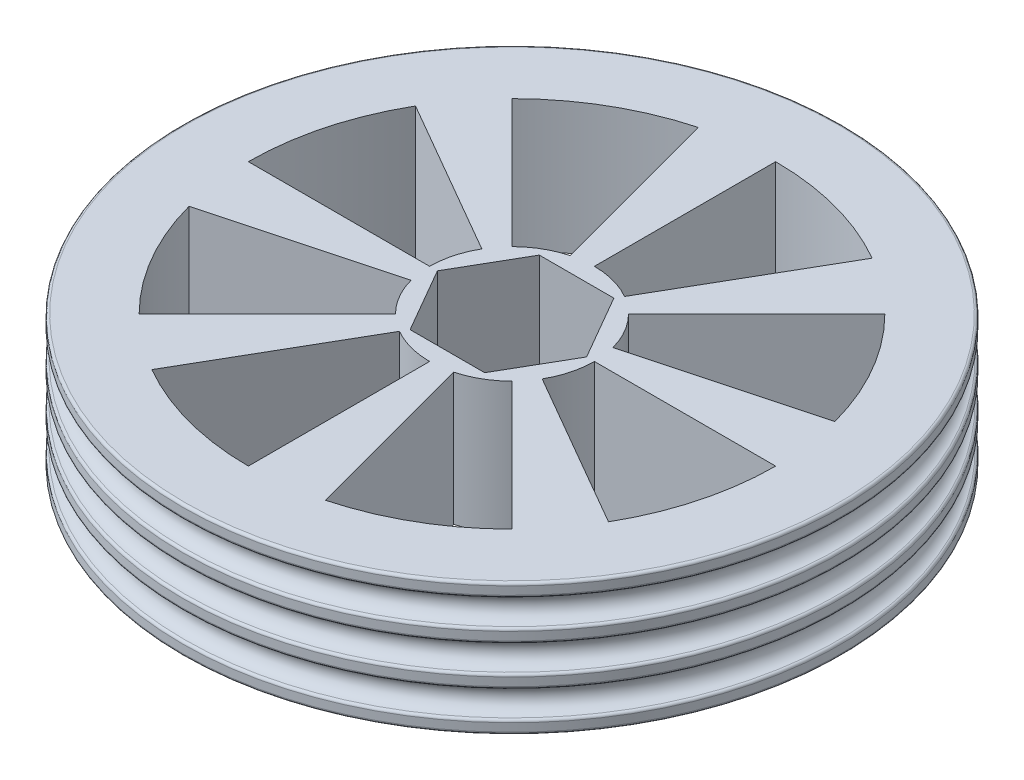
from build123d import *

# Parameters (mm, degrees)
SKETCH1_R           = 31.75
SKETCH1_R_2         = 2.54
BOSS_EXTRUDE1_DEPTH = 12.7
CUT_EXTRUDE1_DEPTH  = 9.525
CUT_EXTRUDE2_DEPTH  = 47.6627796
CIRPATTERN1_COUNT   = 8
SKETCH4_R           = 1.27
FILLET1_R           = 0.254


with BuildPart() as part:
    # Sketch1 → Boss-Extrude1 (new body)
    with BuildSketch(Plane(origin=(0, 0, 0), x_dir=(1, 0, 0), z_dir=(0, 1, 0))):
        with Locations(Location((0, 0, 0), (0, 0, 270))):
            Circle(SKETCH1_R)
        with Locations(Location((0, 0, 0), (0, 0, 270))):
            Circle(SKETCH1_R_2, mode=Mode.SUBTRACT)
    extrude(amount=BOSS_EXTRUDE1_DEPTH)

    # Sketch2 → Cut-Extrude1 (cut)
    with BuildSketch(Plane(origin=(0, 12.7, 0), x_dir=(1, 0, 0), z_dir=(0, 1, 0))):
        Polygon((-7.18570145, 0), (-3.592850725, -6.223), (3.592850725, -6.223), (7.18570145, 0), (3.592850725, 6.223), (-3.592850725, 6.223), align=None)
    extrude(amount=-CUT_EXTRUDE1_DEPTH, mode=Mode.SUBTRACT)

    # Sketch3 → Cut-Extrude2 (cut, through all)
    with BuildSketch(Plane.XZ):
        with BuildLine():
            ThreePointArc((3.96875, -6.874076643), (2.054376171, -7.667036246), (0, -7.9375))
            Line((0, -7.9375), (0, -25.4))
            ThreePointArc((0, -25.4), (6.574003746, -24.534515988), (12.7, -21.997045256))
            Line((12.7, -21.997045256), (3.96875, -6.874076643))
        make_face()
    cut_extrude2 = extrude(amount=-CUT_EXTRUDE2_DEPTH, mode=Mode.SUBTRACT)

    # CirPattern1: Cut-Extrude2 ×8 about axis
    cirpattern1_axis = Axis((0, 0, 0), (0, 1, 0))
    for i in range(1, CIRPATTERN1_COUNT):
        add(cut_extrude2.rotate(cirpattern1_axis, i * 360 / CIRPATTERN1_COUNT), mode=Mode.SUBTRACT)

    # Sketch4 → Cut-Revolve1 (revolve, cut)
    with BuildSketch(Plane.XY, mode=Mode.PRIVATE) as cut_revolve1_sk:
        with Locations((-31.75, 2.54)):
            Circle(SKETCH4_R)
        with Locations((-31.75, 10.16)):
            Circle(SKETCH4_R)
        with Locations((-31.75, 6.35)):
            Circle(SKETCH4_R)
    revolve(cut_revolve1_sk.sketch.rotate(Axis((0, 0, 0), (0, 1, 0)), 270), axis=Axis((0, 0, 0), (0, 1, 0)), mode=Mode.SUBTRACT)

    # Fillet1
    fillet1_edges = [part.edges().sort_by_distance(p)[0] for p in [
        (0, 12.7, -31.75),
        (31.75, 8.89, 0),
        (31.75, 11.43, 0),
        (-31.75, 5.08, 0),
        (-31.75, 7.62, 0),
        (-31.75, 1.27, 0),
        (-31.75, 3.81, 0),
        (0, 0, -31.75),
    ]]
    fillet(fillet1_edges, radius=FILLET1_R)


solid = part.part
